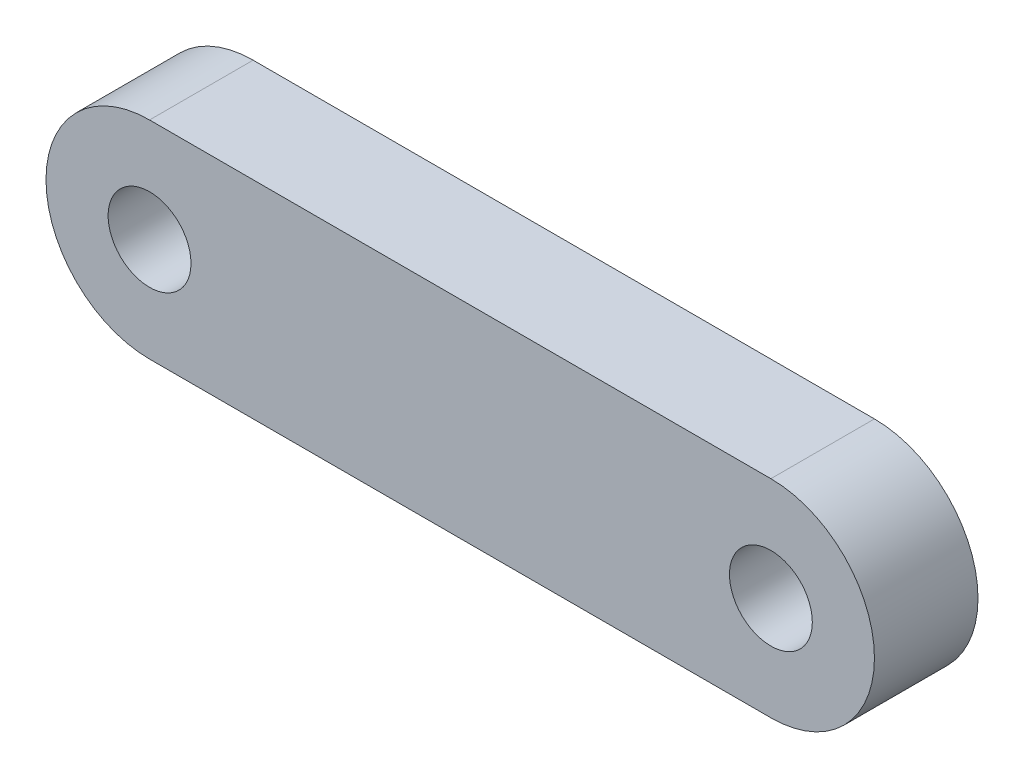
from build123d import *

# Parameters (mm, degrees)
BOSS_EXTRUDE1_DEPTH   = 5
F_8_0MM_DOWEL_HOLE1_D = 8


with BuildPart() as part:
    # Sketch1 → Boss-Extrude1 (new, symmetric)
    with BuildSketch(Plane.XY):
        with BuildLine():
            Line((-30, 10), (30, 10))
            ThreePointArc((30, 10), (40, 0), (30, -10))
            Line((30, -10), (-30, -10))
            ThreePointArc((-30, -10), (-40, 0), (-30, 10))
        make_face()
    extrude(amount=BOSS_EXTRUDE1_DEPTH, both=True)

    # Ø8.0mm Dowel Hole1 (through all)
    with Locations(Plane.XY.offset(5)):
        with Locations((-30, 0), (30, 0)):
            Hole(F_8_0MM_DOWEL_HOLE1_D / 2)


solid = part.part
